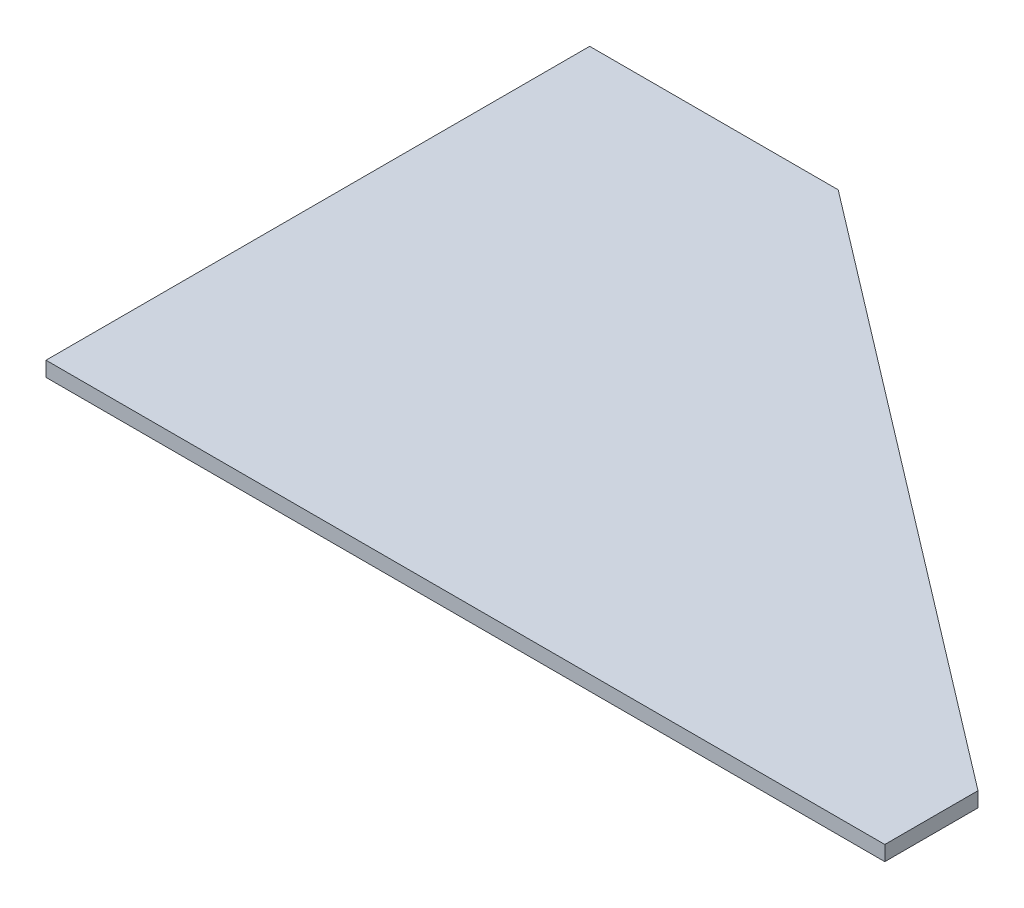
from build123d import *

# Parameters (mm, degrees)
BOSS_EXTRUDE1_DEPTH = 2.4


with BuildPart() as part:
    # Sketch1 → Boss-Extrude1 (new, symmetric)
    with BuildSketch(Plane(origin=(0, 0, 0), x_dir=(1, 0, 0), z_dir=(0, 1, 0))):
        Polygon((-135, 175), (-135, 0), (135, 0), (135, 30), (-55, 175), align=None)
    extrude(amount=BOSS_EXTRUDE1_DEPTH, both=True)


solid = part.part
